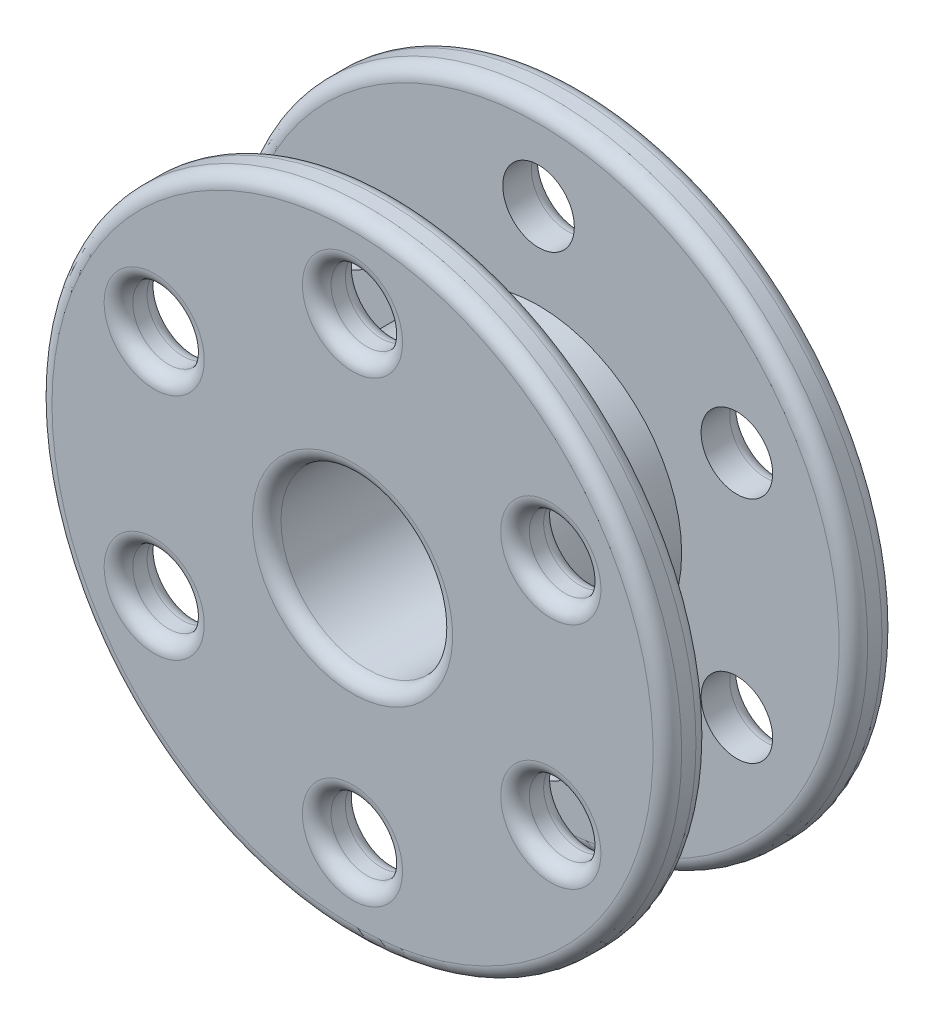
from build123d import *

# Parameters (mm, degrees)
CUT_EXTRUDE1_DEPTH      = 35.985711369
CUT_EXTRUDE1_DEPTH_BACK = 35.985711369
SKETCH2_R               = 2.5
FILLET1_R               = 1


with BuildPart() as part:
    # Sketch1 → Revolve1 (revolve)
    with BuildSketch(Plane(origin=(0, 0, 0), x_dir=(0, 0, -1), z_dir=(1, 0, 0)), mode=Mode.PRIVATE) as revolve1_sk:
        Polygon((-5, 10), (5, 10), (5, 22), (8, 22), (8, 6), (-8, 6), (-8, 22), (-5, 22), align=None)
    revolve(revolve1_sk.sketch.rotate(Axis((0, 0, 8), (0, 0, -1)), 90), axis=Axis((0, 0, 8), (0, 0, -1)))

    # Sketch2 → Cut-Extrude1 (cut, two sides: drawn at the far end of the back side and taken through both)
    with BuildSketch(Plane.XY.offset(8).offset(-CUT_EXTRUDE1_DEPTH_BACK)):
        with Locations((0, 16)):
            Circle(SKETCH2_R)
        with Locations((13.856406461, 8)):
            Circle(SKETCH2_R)
        with Locations((13.856406461, -8)):
            Circle(SKETCH2_R)
        with Locations((0, -16)):
            Circle(SKETCH2_R)
        with Locations((-13.856406461, -8)):
            Circle(SKETCH2_R)
        with Locations((-13.856406461, 8)):
            Circle(SKETCH2_R)
    extrude(amount=CUT_EXTRUDE1_DEPTH + CUT_EXTRUDE1_DEPTH_BACK, mode=Mode.SUBTRACT)

    # Fillet1
    fillet1_edges = [part.edges().sort_by_distance(p)[0] for p in [
        (-22, 0, 5),
        (-2.5, 16, 8),
        (-2.5, 16, 5),
        (-2.5, 16, -8),
        (-16.356406461, 8, 8),
        (-16.356406461, 8, 5),
        (-16.356406461, 8, -8),
        (-16.356406461, -8, 8),
        (-16.356406461, -8, 5),
        (-16.356406461, -8, -8),
        (-2.5, -16, 8),
        (-2.5, -16, 5),
        (-2.5, -16, -8),
        (11.356406461, -8, 8),
        (11.356406461, -8, 5),
        (11.356406461, -8, -8),
        (11.356406461, 8, 8),
        (11.356406461, 8, 5),
        (11.356406461, 8, -8),
        (-10, 0, 5),
        (-22, 0, -5),
        (-22, 0, -8),
        (-6, 0, -8),
        (-6, 0, 8),
        (-22, 0, 8),
    ]]
    fillet(fillet1_edges, radius=FILLET1_R)


solid = part.part
